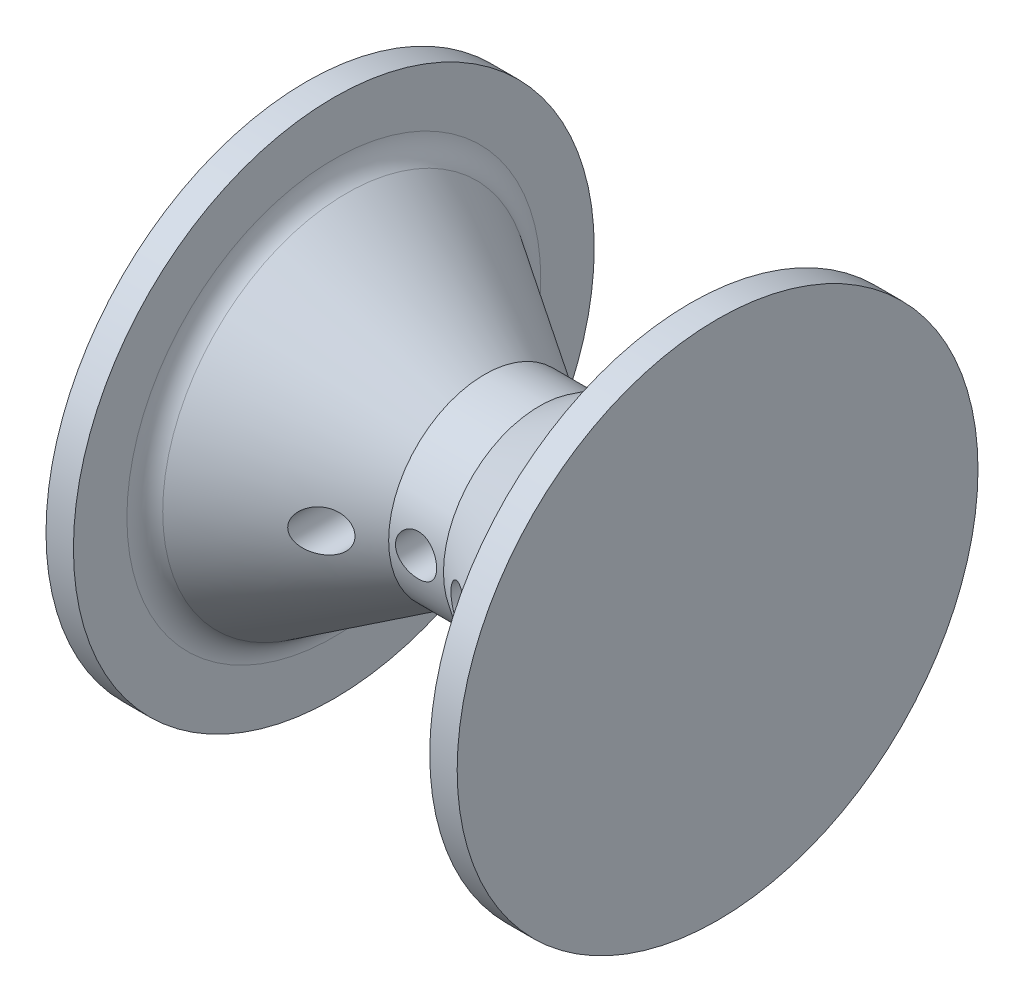
from build123d import *

# Parameters (mm, degrees)
MOTOR_SHAFT_DEPTH  = 13
SKETCH4_R          = 1.5
CUT_EXTRUDE2_DEPTH = 17.5
FILLET1_R          = 2


with BuildPart() as part:
    # Sketch2 → Revolve1 (revolve)
    with BuildSketch(Plane.XY, mode=Mode.PRIVATE) as revolve1_sk:
        Polygon((13, 14), (13, 19), (15, 19), (15, 0), (-15, 0), (-15, 19), (-13, 19), (-13, 14), (-2, 7), (2, 7), align=None)
    revolve(revolve1_sk.sketch.rotate(Axis((0, 0, 0), (1, 0, 0)), 90), axis=Axis((0, 0, 0), (1, 0, 0)))

    # Sketch3 → motor shaft (cut)
    with BuildSketch(Plane.ZY.offset(15)):
        with BuildLine():
            Line((2.9, 1.574801575), (2.9, -1.574801575))
            ThreePointArc((2.9, -1.574801575), (-3.3, 0), (2.9, 1.574801575))
        make_face()
    extrude(amount=-MOTOR_SHAFT_DEPTH, mode=Mode.SUBTRACT)

    # Sketch4 → Cut-Extrude2 (cut, symmetric)
    with BuildSketch(Plane.XY):
        Circle(SKETCH4_R)
        with Locations(Location((5, 0, 0), (0, 0, 3.47e-07))):
            Circle(SKETCH4_R)
        with Locations((-5, 0)):
            Circle(SKETCH4_R)
    extrude(amount=CUT_EXTRUDE2_DEPTH, both=True, mode=Mode.SUBTRACT)

    # Fillet1
    fillet1_edges = [part.edges().sort_by_distance(p)[0] for p in [
        (13, 0, -14),
        (-13, 0, -14),
    ]]
    fillet(fillet1_edges, radius=FILLET1_R)


solid = part.part
